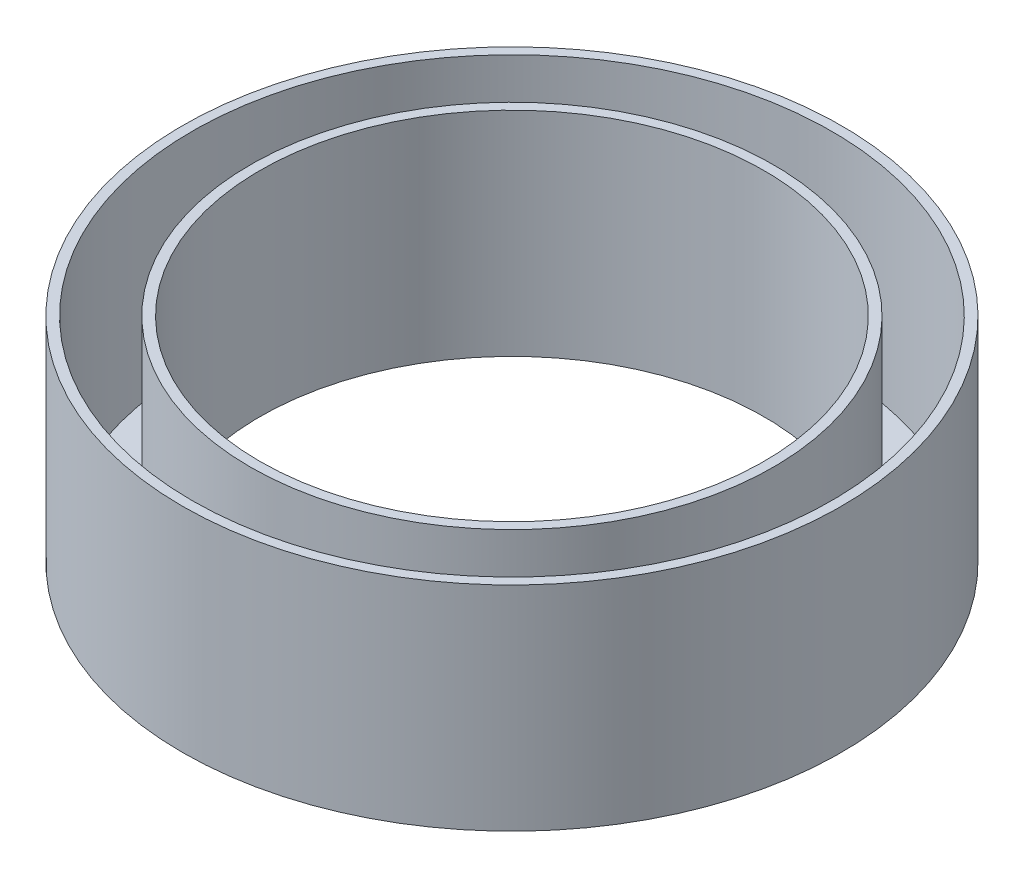
from build123d import *

# Parameters (mm, degrees)
SKETCH_1_R          = 17
SKETCH_1_R_2        = 13
EXTRUDE_1_DEPTH     = 11
SKETCH_2_R          = 16.5
SKETCH_2_R_2        = 13.5
CUT_EXTRUDE_1_DEPTH = 10.6


with BuildPart() as part:
    # 草图1 → 凸台-拉伸1 (new body)
    with BuildSketch(Plane(origin=(0, 0, 0), x_dir=(1, 0, 0), z_dir=(0, 1, 0))):
        with Locations(Location((0, 0, 0), (0, 0, 270))):
            Circle(SKETCH_1_R)
        with Locations(Location((0, 0, 0), (0, 0, 270))):
            Circle(SKETCH_1_R_2, mode=Mode.SUBTRACT)
    extrude(amount=EXTRUDE_1_DEPTH)

    # 草图2 → 切除-拉伸1 (cut)
    with BuildSketch(Plane(origin=(0, 11, 0), x_dir=(1, 0, 0), z_dir=(0, 1, 0))):
        with Locations(Location((0, 0, 0), (0, 0, 270))):
            Circle(SKETCH_2_R)
        with Locations(Location((0, 0, 0), (0, 0, 270))):
            Circle(SKETCH_2_R_2, mode=Mode.SUBTRACT)
    extrude(amount=-CUT_EXTRUDE_1_DEPTH, mode=Mode.SUBTRACT)


solid = part.part
